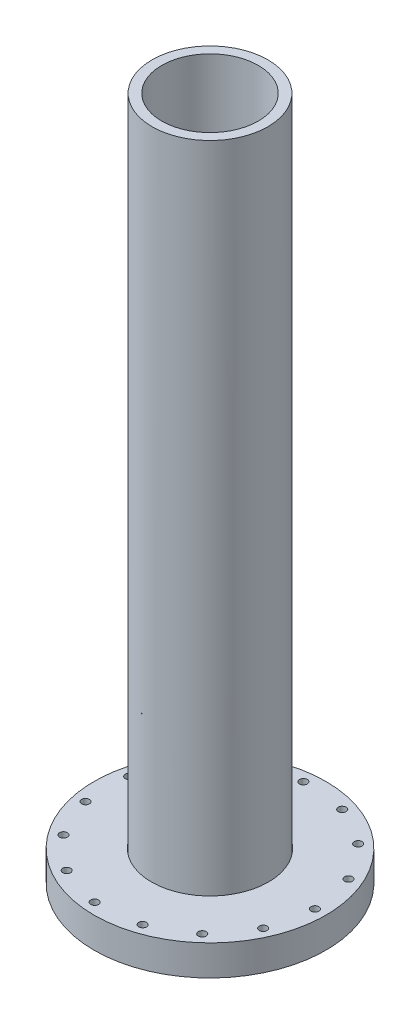
from build123d import *

# Parameters (mm, degrees)
SKETCH1_R           = 38.1
SKETCH1_R_2         = 31.75
BOSS_EXTRUDE1_DEPTH = 450
SKETCH2_R           = 76.2
SKETCH2_R_2         = 38.4556
BOSS_EXTRUDE2_DEPTH = 20
SKETCH5_W           = 2.579751
SKETCH5_H           = 450
CIRPATTERN1_COUNT   = 15
SKETCH6_R           = 55.14
CUT_EXTRUDE1_DEPTH  = 2


with BuildPart() as part:
    # Sketch1 → Boss-Extrude1 (new body)
    with BuildSketch(Plane(origin=(0, 0, 0), x_dir=(1, 0, 0), z_dir=(0, 1, 0))):
        Circle(SKETCH1_R)
        Circle(SKETCH1_R_2, mode=Mode.SUBTRACT)
    extrude(amount=BOSS_EXTRUDE1_DEPTH)


with BuildPart() as body_2:
    # Sketch2 → Boss-Extrude2 (new body)
    with BuildSketch(Plane(origin=(0, 0, 0), x_dir=(1, 0, 0), z_dir=(0, 1, 0))):
        Circle(SKETCH2_R)
        Circle(SKETCH2_R_2, mode=Mode.SUBTRACT)
    extrude(amount=BOSS_EXTRUDE2_DEPTH)

    # Sketch5 → 13/64 (0.20313) Diameter Hole1 (revolve, cut)
    with BuildSketch(Plane(origin=(69, 0, 0), x_dir=(0, 0, -1), z_dir=(1, 0, 0))):
        with Locations((1.2898755, 225)):
            Rectangle(SKETCH5_W, SKETCH5_H)
    f_13_64_0_20313_diameter_hole1 = revolve(axis=Axis((69, -6.35, 0), (0, 1, 0)), mode=Mode.SUBTRACT)

    # CirPattern1: 13/64 (0.20313) Diameter Hole1 ×15 about axis
    cirpattern1_axis = Axis((0, 472.5, 0), (0, -1, 0))
    for i in range(1, CIRPATTERN1_COUNT):
        add(f_13_64_0_20313_diameter_hole1.rotate(cirpattern1_axis, i * 360 / CIRPATTERN1_COUNT), mode=Mode.SUBTRACT)


with BuildPart() as cut_extrude1_tool:
    # Sketch6 → Cut-Extrude1 (new body)
    with BuildSketch(Plane.XZ):
        Circle(SKETCH6_R)
    extrude(amount=-CUT_EXTRUDE1_DEPTH)


with BuildPart() as part_1:
    add(part.part)

    # Cut-Extrude1: cut by cut_extrude1_tool
    add(cut_extrude1_tool.part, mode=Mode.SUBTRACT)


with BuildPart() as body_2_1:
    add(body_2.part)

    # Cut-Extrude1: cut by cut_extrude1_tool
    add(cut_extrude1_tool.part, mode=Mode.SUBTRACT)


solid = Compound([part_1.part, body_2_1.part])
